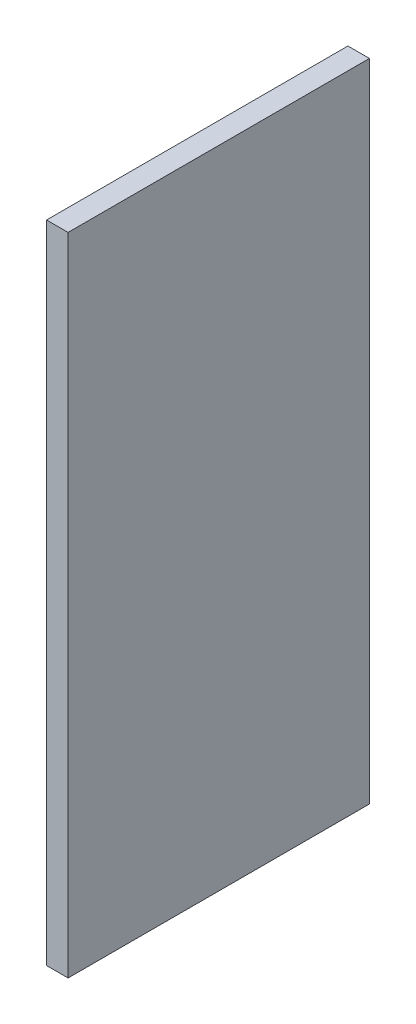
from build123d import *

# Parameters (mm, degrees)
SKIZZE1_W                       = 70
SKIZZE1_H                       = 150
AUFSATZ_LINEAR_AUSTRAGEN1_DEPTH = 5


with BuildPart() as part:
    # Skizze1 → Aufsatz-Linear austragen1 (new body)
    with BuildSketch(Plane(origin=(0, 0, 0), x_dir=(0, 0, -1), z_dir=(1, 0, 0))):
        Rectangle(SKIZZE1_W, SKIZZE1_H)
    extrude(amount=AUFSATZ_LINEAR_AUSTRAGEN1_DEPTH)


solid = part.part
